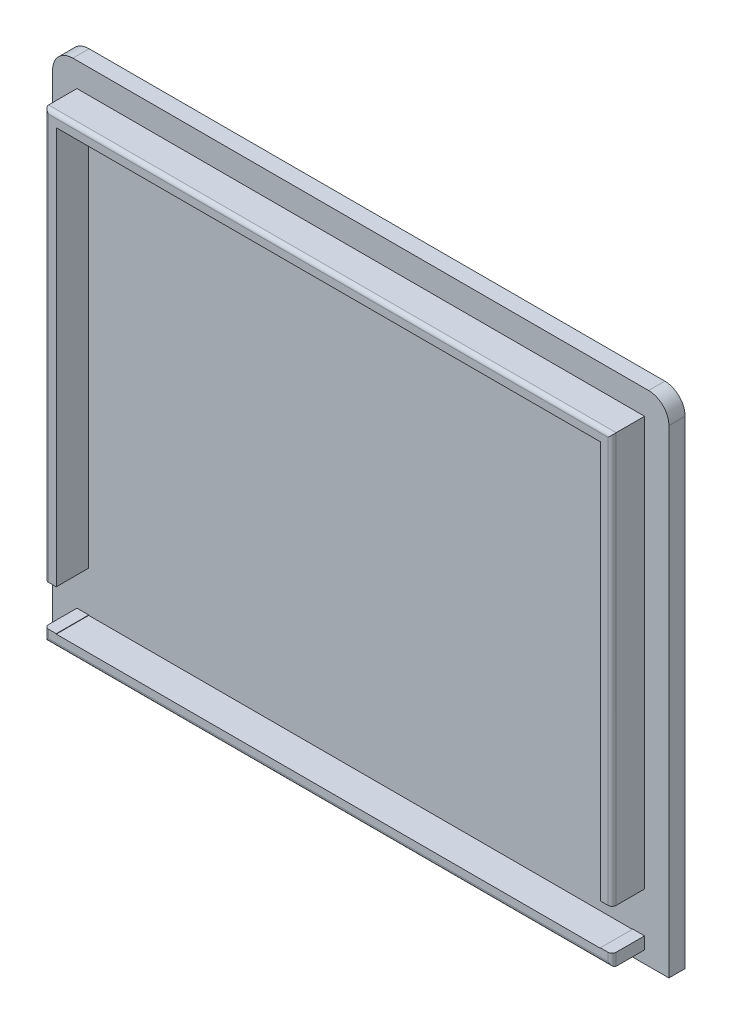
from build123d import *

# Parameters (mm, degrees)
SKETCH1_W           = 139.95
SKETCH1_H           = 113.95
SKETCH1_W_2         = 134.15
SKETCH1_H_2         = 108.15
BOSS_EXTRUDE1_DEPTH = 8
BOSS_EXTRUDE3_DEPTH = 4
FILLET1_R           = 5
FILLET2_R           = 1
CUT_EXTRUDE1_REACH  = 101.409
SKETCH3_W           = 2.9
SKETCH3_H           = 10
CUT_EXTRUDE4_DEPTH  = 3
CUT_EXTRUDE5_DEPTH  = 3


with BuildPart() as part:
    # Sketch1 → Boss-Extrude1 (new body)
    with BuildSketch(Plane.XY):
        Rectangle(SKETCH1_W, SKETCH1_H)
        Rectangle(SKETCH1_W_2, SKETCH1_H_2, mode=Mode.SUBTRACT)
    extrude(amount=BOSS_EXTRUDE1_DEPTH)

    # Sketch2 → Boss-Extrude3 (add)
    with BuildSketch(Plane(origin=(0, 0, 0), x_dir=(-1, 0, 0), z_dir=(0, 0, -1))):
        Polygon((75.975, 62.975), (75.975, -56.975), (75.975, -59.975), (-75.975, -59.975), (-75.975, -56.975), (-75.975, 62.975), align=None)
    extrude(amount=BOSS_EXTRUDE3_DEPTH)

    # Fillet1
    fillet1_edges = [part.edges().sort_by_distance(p)[0] for p in [
        (-75.975, 62.975, -2),
        (75.975, 62.975, -2),
    ]]
    fillet(fillet1_edges, radius=FILLET1_R)

    # Fillet2
    fillet2_edges = [part.edges().sort_by_distance(p)[0] for p in [
        (-69.975, 0, 8),
        (0, -56.975, 8),
        (69.975, 0, 8),
        (0, 56.975, 8),
    ]]
    fillet(fillet2_edges, radius=FILLET2_R)

    # Cut-Extrude1: up to this face of the body (flat: up to its plane)
    cut_extrude1_end = Plane(part.part.faces().sort_by_distance((0, 0, 0))[0])
    # Sketch3 → Cut-Extrude1 (cut, up to the picked face)
    with BuildSketch(Plane.XY.offset(8), mode=Mode.PRIVATE) as cut_extrude1_sk1:
        with Locations((68.525, -48.975)):
            Rectangle(SKETCH3_W, SKETCH3_H)
    cut_extrude1_tool1 = split(extrude(cut_extrude1_sk1.sketch, amount=-CUT_EXTRUDE1_REACH, mode=Mode.PRIVATE), bisect_by=cut_extrude1_end, keep=Keep.BOTH, mode=Mode.PRIVATE)
    # Sketch3 → Cut-Extrude1 (cut, up to the picked face)
    with BuildSketch(Plane.XY.offset(8), mode=Mode.PRIVATE) as cut_extrude1_sk2:
        with Locations((-68.525, -48.975)):
            Rectangle(SKETCH3_W, SKETCH3_H)
    cut_extrude1_tool2 = split(extrude(cut_extrude1_sk2.sketch, amount=-CUT_EXTRUDE1_REACH, mode=Mode.PRIVATE), bisect_by=cut_extrude1_end, keep=Keep.BOTH, mode=Mode.PRIVATE)
    add(cut_extrude1_tool1.solids().sort_by(Axis((68.525, -48.975, 8), (0, 0, -1)))[0], mode=Mode.SUBTRACT)
    add(cut_extrude1_tool2.solids().sort_by(Axis((-68.525, -48.975, 8), (0, 0, -1)))[0], mode=Mode.SUBTRACT)

    # Sketch5 → Cut-Extrude4 (cut)
    with BuildSketch(Plane(origin=(0, 0, -4), x_dir=(-1, 0, 0), z_dir=(0, 0, -1))):
        with BuildLine():
            Line((-8, -39.975), (8, -39.975))
            ThreePointArc((8, -39.975), (5, -24.975), (8, -9.975))
            Line((8, -9.975), (-8, -9.975))
            ThreePointArc((-8, -9.975), (-5, -24.975), (-8, -39.975))
        make_face()
        with BuildLine():
            ThreePointArc((6.818181818, 16.664146858), (0, 45.025), (-6.818181818, 16.664146858))
            ThreePointArc((-6.818181818, 16.664146858), (-23.160035818, -0.997809526), (0, 5.530102572))
            ThreePointArc((0, 5.530102572), (23.160035818, -0.997809526), (6.818181818, 16.664146858))
        make_face()
    extrude(amount=-CUT_EXTRUDE4_DEPTH, mode=Mode.SUBTRACT)

    # Sketch4 → Cut-Extrude5 (cut)
    # profile 1 of 3: a face of its own
    with BuildSketch(Plane(origin=(0, 0, -4), x_dir=(-1, 0, 0), z_dir=(0, 0, -1))):
        with BuildLine():
            Line((67.060737179, -47.975), (67.85, -47.975))
            add(Edge.make_bspline(
                [(67.85, -47.975), (67.939489015, -47.975739101), (68.112543394, -47.977168378), (68.363502606, -47.988953128), (68.596414563, -48.009753608), (68.811705444, -48.038542918), (69.009392752, -48.075272961), (69.189551988, -48.119748414), (69.352362713, -48.172364307), (69.498278598, -48.235583727), (69.632632542, -48.306525016), (69.758540637, -48.387472451), (69.87817145, -48.477415083), (69.992331717, -48.57578381), (70.098707369, -48.68473934), (70.198795395, -48.803133228), (70.292978902, -48.93070882), (70.380940152, -49.066141699), (70.460062097, -49.209336608), (70.529181221, -49.359003707), (70.588524249, -49.513723597), (70.635461235, -49.674345605), (70.672566325, -49.839958984), (70.699539505, -50.011209341), (70.716004863, -50.187882038), (70.717721172, -50.307362904), (70.718589744, -50.367828526)],
                knots=[0, 0, 0, 0, 1.508928034, 2.917973822, 4.235011166, 5.450779055, 6.579221784, 7.623755204, 8.577985451, 9.460610614, 10.301756591, 11.137250569, 11.981705789, 12.823774396, 13.675702816, 14.546470419, 15.435981066, 16.347923198, 17.267651715, 18.192054867, 19.125737078, 20.059147693, 21.011116727, 21.985721956, 22.980635317, 24, 24, 24, 24], degree=3))
            add(Edge.make_bspline(
                [(70.718589744, -50.367828526), (70.717369345, -50.43029921), (70.714943631, -50.55446842), (70.697538083, -50.738471559), (70.66938982, -50.918748401), (70.630590409, -51.095236295), (70.579490275, -51.268005638), (70.515686196, -51.436146142), (70.443036517, -51.601339576), (70.357663757, -51.760188602), (70.265594594, -51.912708133), (70.165913172, -52.055319884), (70.061363711, -52.187869937), (69.949317317, -52.308539853), (69.831926239, -52.419049229), (69.709146889, -52.519395516), (69.579654742, -52.608186768), (69.443595456, -52.687000435), (69.297346659, -52.756087037), (69.138669441, -52.814613328), (68.967076134, -52.864915389), (68.781745433, -52.904184853), (68.583561429, -52.936242637), (68.371958936, -52.959203839), (68.146962039, -52.971773686), (67.992576554, -52.973903566), (67.913100962, -52.975)],
                knots=[0, 0, 0, 0, 1.035326767, 2.057856534, 3.060426681, 4.057975219, 5.050723532, 6.043595218, 7.036960241, 8.039530388, 9.030318104, 9.988216712, 10.921569661, 11.826132526, 12.714780289, 13.59198308, 14.451536877, 15.31430869, 16.195534129, 17.128821459, 18.114698389, 19.15667332, 20.266554844, 21.441073174, 22.682698532, 24, 24, 24, 24], degree=3))
            Line((67.913100962, -52.975), (66.359615385, -52.975))
            Line((66.359615385, -52.975), (67.060737179, -47.975))
        make_face()
        with BuildLine():
            Line((67.85, -48.808333333), (67.383253205, -52.141666667))
            Line((67.383253205, -52.141666667), (67.705769231, -52.141666667))
            add(Edge.make_bspline(
                [(67.705769231, -52.141666667), (67.76587375, -52.141358826), (67.881440763, -52.14076692), (68.048380967, -52.134140543), (68.202487745, -52.126252045), (68.343681397, -52.111604127), (68.472477829, -52.095304964), (68.588002124, -52.074070086), (68.691583006, -52.051245463), (68.754602344, -52.029693974), (68.784495192, -52.019471154)],
                knots=[0, 0, 0, 0, 1.323091274, 2.54399687, 3.677836413, 4.719289959, 5.668358043, 6.534823038, 7.305002022, 8, 8, 8, 8], degree=3))
            add(Edge.make_bspline(
                [(68.784495192, -52.019471154), (68.822904065, -52.004542925), (68.899206829, -51.974886622), (69.006814796, -51.917199236), (69.111221636, -51.85605745), (69.20786186, -51.784140371), (69.300161121, -51.706072676), (69.384426997, -51.618518991), (69.46475042, -51.524699568), (69.538284599, -51.422807371), (69.605509205, -51.314476693), (69.662757433, -51.198860236), (69.712189873, -51.077494259), (69.751772655, -50.949375796), (69.783135509, -50.815516406), (69.804562072, -50.675518651), (69.819521218, -50.529410579), (69.820603138, -50.429633617), (69.821153846, -50.378846154)],
                knots=[0, 0, 0, 0, 0.952655881, 1.892538673, 2.821337892, 3.750040712, 4.676008024, 5.615700279, 6.558436491, 7.532008524, 8.520486916, 9.505184105, 10.513747313, 11.549809891, 12.604882282, 13.692134403, 14.825273528, 16, 16, 16, 16], degree=3))
            add(Edge.make_bspline(
                [(69.821153846, -50.378846154), (69.82057836, -50.337099302), (69.819453603, -50.25550742), (69.810615647, -50.135706403), (69.794234736, -50.021079681), (69.772795243, -49.911563237), (69.744300572, -49.807252553), (69.710345217, -49.708170116), (69.670789709, -49.613596059), (69.607476318, -49.496949218), (69.517279253, -49.36079732), (69.385458933, -49.217353735), (69.233171753, -49.093770916), (69.09042655, -49.008251767), (68.965840799, -48.949457957), (68.863496268, -48.911837894), (68.75377539, -48.879536039), (68.636479141, -48.854242418), (68.512301282, -48.832510302), (68.380392105, -48.819480286), (68.241102039, -48.80982901), (68.145491647, -48.808840797), (68.096394231, -48.808333333)],
                knots=[0, 0, 0, 0, 0.94164902, 1.840400246, 2.70735158, 3.552169971, 4.356016339, 5.144331422, 5.913676253, 6.665006732, 8.135486087, 9.585359709, 11.041478777, 12.544856699, 13.326488422, 14.146229178, 15.001754778, 15.904378661, 16.85152277, 17.843704754, 18.892709022, 20, 20, 20, 20], degree=3))
            Line((68.096394231, -48.808333333), (67.85, -48.808333333))
        make_face(mode=Mode.SUBTRACT)
    # profile 2 of 3: a face of its own
    with BuildSketch(Plane(origin=(0, 0, -4), x_dir=(-1, 0, 0), z_dir=(0, 0, -1))):
        with BuildLine():
            Line((65.971995192, -48.670112179), (65.276883013, -49.276081731))
            add(Edge.make_bspline(
                [(65.276883013, -49.276081731), (65.242142955, -49.22915327), (65.175564275, -49.13921574), (65.069917571, -49.018585277), (64.96870415, -48.913758858), (64.866753016, -48.830164293), (64.767379689, -48.763878641), (64.669718207, -48.715862672), (64.573219606, -48.685520347), (64.508851058, -48.681890344), (64.477604167, -48.680128205)],
                knots=[0, 0, 0, 0, 1.358515141, 2.603569235, 3.730126198, 4.746094498, 5.666493297, 6.504166865, 7.273866877, 8, 8, 8, 8], degree=3))
            add(Edge.make_bspline(
                [(64.477604167, -48.680128205), (64.448088809, -48.681406013), (64.391326843, -48.683863409), (64.309848817, -48.704814244), (64.235795933, -48.738514953), (64.172218566, -48.787267184), (64.119118826, -48.843476491), (64.079691549, -48.906553819), (64.056729614, -48.976078937), (64.053546758, -49.024179992), (64.051923077, -49.048717949)],
                knots=[0, 0, 0, 0, 1.130304997, 2.173727141, 3.204821236, 4.229135679, 5.225705988, 6.15679035, 7.05971714, 8, 8, 8, 8], degree=3))
            add(Edge.make_bspline(
                [(64.051923077, -49.048717949), (64.053401799, -49.07289129), (64.056511998, -49.123735124), (64.079298949, -49.200813603), (64.113767227, -49.282027552), (64.155225186, -49.352643187), (64.201773543, -49.416764385), (64.250553305, -49.479506496), (64.314246725, -49.554522404), (64.391750863, -49.642670978), (64.482325285, -49.744695964), (64.588319196, -49.859112886), (64.707824133, -49.986673182), (64.792706061, -50.075759568), (64.837179487, -50.122435897)],
                knots=[0, 0, 0, 0, 0.642317819, 1.35098826, 2.122816345, 2.986294386, 3.520967692, 4.229638134, 5.099348126, 6.137609051, 7.351336444, 8.727500291, 10.285391505, 12, 12, 12, 12], degree=3))
            add(Edge.make_bspline(
                [(64.837179487, -50.122435897), (64.861305182, -50.147392731), (64.907597702, -50.195280044), (64.97255224, -50.265217898), (65.030525501, -50.330037008), (65.0840516, -50.387467177), (65.129873366, -50.440473709), (65.16899651, -50.487784898), (65.202209696, -50.528735007), (65.22184568, -50.554420625), (65.230809295, -50.566145833)],
                knots=[0, 0, 0, 0, 1.403722598, 2.693470914, 3.859630393, 4.920438112, 5.867965235, 6.69256451, 7.40316977, 8, 8, 8, 8], degree=3))
            add(Edge.make_bspline(
                [(65.230809295, -50.566145833), (65.266502963, -50.615457072), (65.335345409, -50.710563752), (65.424639174, -50.855166407), (65.498495084, -50.994488295), (65.55653096, -51.130178277), (65.599945632, -51.263720469), (65.631389584, -51.397322326), (65.651196776, -51.532095144), (65.653393608, -51.622770784), (65.654487179, -51.667908654)],
                knots=[0, 0, 0, 0, 1.215130546, 2.343624586, 3.390252636, 4.360992906, 5.286454858, 6.190345157, 7.099163061, 8, 8, 8, 8], degree=3))
            add(Edge.make_bspline(
                [(65.654487179, -51.667908654), (65.653126356, -51.717728183), (65.65044825, -51.815773267), (65.629696211, -51.95962383), (65.597373309, -52.097553452), (65.549174959, -52.228733477), (65.489661763, -52.354591371), (65.41412687, -52.473284156), (65.32723369, -52.586820109), (65.226920501, -52.69251699), (65.117126107, -52.789176305), (64.997572152, -52.87288005), (64.871203723, -52.944226396), (64.736736218, -53.002963609), (64.594579394, -53.047638074), (64.444986854, -53.079413555), (64.288234747, -53.100506006), (64.180866931, -53.102292758), (64.126041667, -53.103205128)],
                knots=[0, 0, 0, 0, 1.018989505, 2.005376454, 2.968035412, 3.912365187, 4.859556873, 5.811049809, 6.78527381, 7.780773345, 8.787785161, 9.773320145, 10.761314359, 11.752515283, 12.770107012, 13.804505292, 14.878913802, 16, 16, 16, 16], degree=3))
            add(Edge.make_bspline(
                [(64.126041667, -53.103205128), (64.083952126, -53.102361781), (64.00063197, -53.100692297), (63.877136247, -53.08960776), (63.756634854, -53.070685012), (63.639304873, -53.043378081), (63.524901318, -53.009281499), (63.413245829, -52.968354399), (63.304617786, -52.918816915), (63.198878073, -52.861957171), (63.096016916, -52.797552789), (62.99665152, -52.724835552), (62.899709798, -52.645207745), (62.806462344, -52.55716128), (62.714940378, -52.463126546), (62.626746893, -52.360964361), (62.542768076, -52.250246537), (62.48945822, -52.172927549), (62.462379808, -52.133653846)],
                knots=[0, 0, 0, 0, 1.003438088, 1.986398949, 2.953471805, 3.909242729, 4.856156023, 5.798037682, 6.742035895, 7.700024963, 8.658509928, 9.632892881, 10.633707184, 11.647385023, 12.688779161, 13.761077638, 14.862753205, 16, 16, 16, 16], degree=3))
            Line((62.462379808, -52.133653846), (63.202564103, -51.551722756))
            add(Edge.make_bspline(
                [(63.202564103, -51.551722756), (63.239431585, -51.608411249), (63.310141073, -51.717136175), (63.425394275, -51.863895558), (63.542894434, -51.988624664), (63.663068189, -52.090838529), (63.786302164, -52.170368781), (63.911711745, -52.227217644), (64.03985507, -52.263782745), (64.126808932, -52.267847524), (64.170112179, -52.269871795)],
                knots=[0, 0, 0, 0, 1.289844872, 2.473840458, 3.555310637, 4.554525788, 5.477014656, 6.343795492, 7.175205895, 8, 8, 8, 8], degree=3))
            add(Edge.make_bspline(
                [(64.170112179, -52.269871795), (64.21006689, -52.268120768), (64.287846293, -52.264712062), (64.399109366, -52.232974657), (64.501189018, -52.184049392), (64.589563377, -52.114191799), (64.664012582, -52.032148721), (64.718130504, -51.938684089), (64.750710819, -51.836277401), (64.754906054, -51.76530041), (64.757051282, -51.72900641)],
                knots=[0, 0, 0, 0, 1.07813582, 2.098795369, 3.104167493, 4.120866408, 5.124778177, 6.083335831, 7.019916046, 8, 8, 8, 8], degree=3))
            add(Edge.make_bspline(
                [(64.757051282, -51.72900641), (64.756026454, -51.699506636), (64.753941764, -51.639498656), (64.732210862, -51.550123342), (64.699958608, -51.459497178), (64.66086793, -51.382904374), (64.618706098, -51.315742561), (64.574056304, -51.254922782), (64.51787406, -51.183534589), (64.448368726, -51.103253595), (64.368381479, -51.011369514), (64.274881594, -50.911111578), (64.170856442, -50.799161956), (64.096165469, -50.722566509), (64.05693109, -50.682331731)],
                knots=[0, 0, 0, 0, 0.82235112, 1.672813781, 2.554588539, 3.50524042, 4.06657461, 4.767804758, 5.610876414, 6.602916144, 7.732569792, 9.01260869, 10.430754915, 12, 12, 12, 12], degree=3))
            add(Edge.make_bspline(
                [(64.05693109, -50.682331731), (64.015405478, -50.639383216), (63.935129831, -50.556356869), (63.821561289, -50.434848362), (63.719263026, -50.321754829), (63.628350876, -50.216957267), (63.548749743, -50.120267292), (63.479082248, -50.032418416), (63.421457019, -49.952251781), (63.388956746, -49.900237756), (63.373838141, -49.876041667)],
                knots=[0, 0, 0, 0, 1.354401886, 2.618275412, 3.770529779, 4.811580489, 5.763301005, 6.60974666, 7.35327647, 8, 8, 8, 8], degree=3))
            add(Edge.make_bspline(
                [(63.373838141, -49.876041667), (63.340081177, -49.815748684), (63.274586839, -49.69876989), (63.207067032, -49.514656212), (63.163067024, -49.33290791), (63.15731513, -49.211549539), (63.154487179, -49.151883013)],
                knots=[0, 0, 0, 0, 1.081804801, 2.098888081, 3.065307629, 4, 4, 4, 4], degree=3))
            add(Edge.make_bspline(
                [(63.154487179, -49.151883013), (63.155502603, -49.113442083), (63.157522469, -49.036975891), (63.17206395, -48.924121851), (63.194329197, -48.813767873), (63.229823673, -48.707587833), (63.270759041, -48.60292298), (63.32426665, -48.502523487), (63.384382644, -48.403688285), (63.432611851, -48.342462164), (63.456971154, -48.311538462)],
                knots=[0, 0, 0, 0, 1.012167245, 2.013389743, 2.992947912, 3.971795425, 4.958040075, 5.949133471, 6.964161297, 8, 8, 8, 8], degree=3))
            add(Edge.make_bspline(
                [(63.456971154, -48.311538462), (63.489127543, -48.274269442), (63.552551532, -48.200761504), (63.662287074, -48.106797467), (63.778637261, -48.025633917), (63.904106594, -47.960475945), (64.037252283, -47.908544284), (64.179340642, -47.873305174), (64.329282726, -47.850283613), (64.432109428, -47.847974145), (64.484615385, -47.846794872)],
                knots=[0, 0, 0, 0, 1.010152455, 1.992384693, 2.959065588, 3.919519142, 4.890305168, 5.888624478, 6.921877408, 8, 8, 8, 8], degree=3))
            add(Edge.make_bspline(
                [(64.484615385, -47.846794872), (64.557223086, -47.849329714), (64.700452401, -47.854330062), (64.911163979, -47.893195124), (65.111959818, -47.959074726), (65.304848108, -48.048582859), (65.486696961, -48.166459897), (65.659935031, -48.30895151), (65.82446672, -48.477073345), (65.921902809, -48.604567033), (65.971995192, -48.670112179)],
                knots=[0, 0, 0, 0, 0.984438778, 1.941949542, 2.894274057, 3.844399604, 4.817935388, 5.825099055, 6.88187249, 8, 8, 8, 8], degree=3))
        make_face()
    # profile 3 of 3: a face of its own
    with BuildSketch(Plane(origin=(0, 0, -4), x_dir=(-1, 0, 0), z_dir=(0, 0, -1))):
        with BuildLine():
            Line((59.432532051, -47.975), (60.181730769, -47.975))
            add(Edge.make_bspline(
                [(60.181730769, -47.975), (60.23683124, -47.975169362), (60.343424379, -47.975496996), (60.497734921, -47.984082546), (60.641349832, -47.996063232), (60.77428625, -48.010992682), (60.895806904, -48.033574682), (61.006664121, -48.059229727), (61.106725459, -48.089609), (61.224262393, -48.137922686), (61.3570057, -48.211579947), (61.501980636, -48.319176213), (61.627152905, -48.451872612), (61.73682615, -48.600870128), (61.825976507, -48.764069112), (61.889158786, -48.936970041), (61.929014611, -49.116022959), (61.934019399, -49.237816277), (61.936538462, -49.29911859)],
                knots=[0, 0, 0, 0, 1.060182399, 2.050947427, 2.972933909, 3.833603532, 4.623758792, 5.349968742, 6.022619805, 6.633490032, 7.792338899, 8.934684725, 10.0933911, 11.288487101, 12.487324871, 13.658169267, 14.821284765, 16, 16, 16, 16], degree=3))
            add(Edge.make_bspline(
                [(61.936538462, -49.29911859), (61.934666728, -49.350627714), (61.930961844, -49.452584142), (61.905507248, -49.603397105), (61.861814818, -49.749402656), (61.802250162, -49.890165689), (61.725948224, -50.022732756), (61.634058818, -50.145044534), (61.526511174, -50.256003733), (61.444880836, -50.319672363), (61.403685897, -50.351802885)],
                knots=[0, 0, 0, 0, 1.008802286, 1.996808917, 2.985853824, 3.987935791, 4.984003692, 5.974085787, 6.977617699, 8, 8, 8, 8], degree=3))
            add(Edge.make_bspline(
                [(61.403685897, -50.351802885), (61.456422973, -50.391008231), (61.559418619, -50.467576375), (61.694071153, -50.600055784), (61.808329362, -50.741195607), (61.903169433, -50.891625594), (61.975083749, -51.053141037), (62.027538873, -51.223534521), (62.059531405, -51.403620416), (62.06298254, -51.526884362), (62.06474359, -51.589783654)],
                knots=[0, 0, 0, 0, 1.076867414, 2.103124847, 3.088410714, 4.050300241, 5.011160291, 5.979497965, 6.968975523, 8, 8, 8, 8], degree=3))
            add(Edge.make_bspline(
                [(62.06474359, -51.589783654), (62.06228784, -51.655414409), (62.057431699, -51.785196435), (62.017224912, -51.975350021), (61.950337071, -52.15666225), (61.85804987, -52.326168201), (61.748576695, -52.481393493), (61.623039321, -52.615941009), (61.486043592, -52.729323549), (61.36054305, -52.806509992), (61.25120458, -52.855715187), (61.160686322, -52.88755788), (61.061658627, -52.914868115), (60.953723863, -52.935976926), (60.837581379, -52.954719636), (60.71273213, -52.965646977), (60.579495128, -52.974563194), (60.487571217, -52.974851336), (60.440144231, -52.975)],
                knots=[0, 0, 0, 0, 1.303747164, 2.57810456, 3.844347155, 5.133141427, 6.403898642, 7.610790585, 8.780141826, 9.92981316, 10.526901919, 11.160883678, 11.835562906, 12.567100275, 13.346228134, 14.173084326, 15.057425816, 16, 16, 16, 16], degree=3))
            Line((60.440144231, -52.975), (58.731410256, -52.975))
            Line((58.731410256, -52.975), (59.432532051, -47.975))
        make_face()
        with BuildLine():
            Line((60.058533654, -49.962179487), (60.222796474, -49.962179487))
            add(Edge.make_bspline(
                [(60.222796474, -49.962179487), (60.252182509, -49.962046969), (60.308633852, -49.961792399), (60.389739998, -49.958219942), (60.463682483, -49.955254152), (60.52970923, -49.947580797), (60.588656386, -49.940098528), (60.639993899, -49.929824353), (60.684748894, -49.919894799), (60.733415777, -49.900199729), (60.788899741, -49.870873831), (60.847278157, -49.820840794), (60.901774449, -49.760661148), (60.94913663, -49.688509985), (60.98897619, -49.608276945), (61.018000126, -49.522055411), (61.035602259, -49.43137233), (61.037920815, -49.369643694), (61.039102564, -49.33818109)],
                knots=[0, 0, 0, 0, 1.186855437, 2.279980363, 3.279410352, 4.174486674, 4.964087364, 5.678215456, 6.289867256, 6.810787847, 7.794535574, 8.809853451, 9.898476814, 11.065474595, 12.28378738, 13.507759838, 14.729724625, 16, 16, 16, 16], degree=3))
            add(Edge.make_bspline(
                [(61.039102564, -49.33818109), (61.038164873, -49.30940654), (61.036330507, -49.253116057), (61.021410187, -49.172088356), (60.995851857, -49.097272997), (60.960964128, -49.029515095), (60.918358651, -48.969546713), (60.868735734, -48.919064494), (60.811544796, -48.880707215), (60.758529472, -48.856893924), (60.710105137, -48.841912736), (60.664995202, -48.833704793), (60.611566887, -48.825612193), (60.54977706, -48.818638619), (60.479604869, -48.813766934), (60.401097404, -48.811113901), (60.314286366, -48.809048598), (60.253513701, -48.808578625), (60.221794872, -48.808333333)],
                knots=[0, 0, 0, 0, 1.218919407, 2.384522534, 3.476335358, 4.558478189, 5.602963123, 6.583479505, 7.541062698, 8.503650716, 9.036284489, 9.68562569, 10.444048854, 11.326896936, 12.319891551, 13.424375389, 14.655714728, 16, 16, 16, 16], degree=3))
            Line((60.221794872, -48.808333333), (60.058533654, -49.962179487))
        make_face(mode=Mode.SUBTRACT)
        with BuildLine():
            Line((59.755048077, -52.141666667), (60.333974359, -52.161698718))
            add(Edge.make_bspline(
                [(60.333974359, -52.161698718), (60.369046729, -52.161087154), (60.436948801, -52.159903131), (60.53494758, -52.1518426), (60.625734075, -52.139175163), (60.709032772, -52.120618263), (60.784383084, -52.094962939), (60.853351719, -52.066420055), (60.914936282, -52.03151596), (60.968500442, -51.989612656), (61.015333145, -51.943750352), (61.056403659, -51.893947173), (61.089993971, -51.839750873), (61.118806626, -51.781929331), (61.140293765, -51.719892446), (61.156914347, -51.653968898), (61.165543417, -51.584005998), (61.166712856, -51.536051029), (61.167307692, -51.511658654)],
                knots=[0, 0, 0, 0, 1.397694852, 2.706015503, 3.915979288, 5.048940076, 6.100867759, 7.08451858, 8.020296798, 8.911894717, 9.786956932, 10.628604265, 11.477686511, 12.322692889, 13.198058541, 14.088762429, 15.027845792, 16, 16, 16, 16], degree=3))
            add(Edge.make_bspline(
                [(61.167307692, -51.511658654), (61.165652965, -51.475501401), (61.162418803, -51.404832101), (61.140254112, -51.30126643), (61.100187597, -51.204846131), (61.047277566, -51.114547653), (60.981852421, -51.033630888), (60.904072227, -50.965281185), (60.816418497, -50.910088721), (60.734636511, -50.874439068), (60.660256697, -50.851543291), (60.591592815, -50.838711458), (60.51193705, -50.825047767), (60.420505804, -50.816184693), (60.317776136, -50.806309133), (60.203134267, -50.801143217), (60.076926094, -50.79693775), (59.989093668, -50.796000798), (59.943349359, -50.795512821)],
                knots=[0, 0, 0, 0, 1.073285305, 2.0977346, 3.124673681, 4.15980554, 5.195316882, 6.199430094, 7.219507642, 8.258002558, 8.838009902, 9.526070556, 10.329324443, 11.23662489, 12.251441162, 13.39271889, 14.642092945, 16, 16, 16, 16], degree=3))
            Line((59.943349359, -50.795512821), (59.755048077, -52.141666667))
        make_face(mode=Mode.SUBTRACT)
    extrude(amount=-CUT_EXTRUDE5_DEPTH, mode=Mode.SUBTRACT)


solid = part.part
